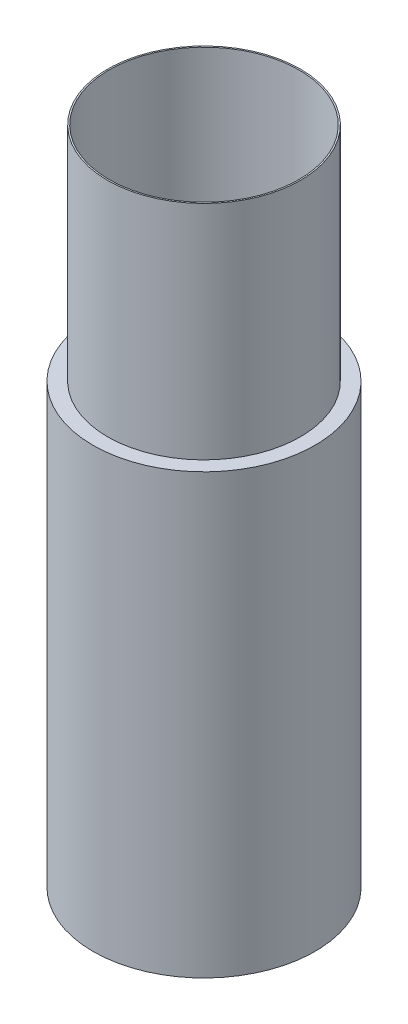
from build123d import *

# Parameters (mm, degrees)
SKETCH1_W                = 10
SKETCH1_H                = 300
BOSS_EXTRUDE1_DEPTH      = 152
BOSS_EXTRUDE1_DEPTH_BACK = 152
SKETCH3_R                = 66
SKETCH3_R_2              = 65


with BuildPart() as part:
    # Sketch1 → Revolve1 (revolve)
    with BuildSketch(Plane.XY, mode=Mode.PRIVATE) as revolve1_sk:
        with Locations((71, 150)):
            Rectangle(SKETCH1_W, SKETCH1_H)
    revolve(revolve1_sk.sketch.rotate(Axis((0, 204.615384615, 0), (0, -1, 0)), 90), axis=Axis((0, 204.615384615, 0), (0, -1, 0)))

    # Sketch3 → Boss-Extrude1 (add, two sides: drawn at the far end of the back side and taken through both)
    with BuildSketch(Plane(origin=(0, 300, 0), x_dir=(1, 0, 0), z_dir=(0, 1, 0)).offset(-BOSS_EXTRUDE1_DEPTH_BACK)):
        with Locations(Location((0, 0, 0), (0, 0, 270))):
            Circle(SKETCH3_R)
        with Locations(Location((0, 0, 0), (0, 0, 270))):
            Circle(SKETCH3_R_2, mode=Mode.SUBTRACT)
    extrude(amount=BOSS_EXTRUDE1_DEPTH + BOSS_EXTRUDE1_DEPTH_BACK)


solid = part.part
